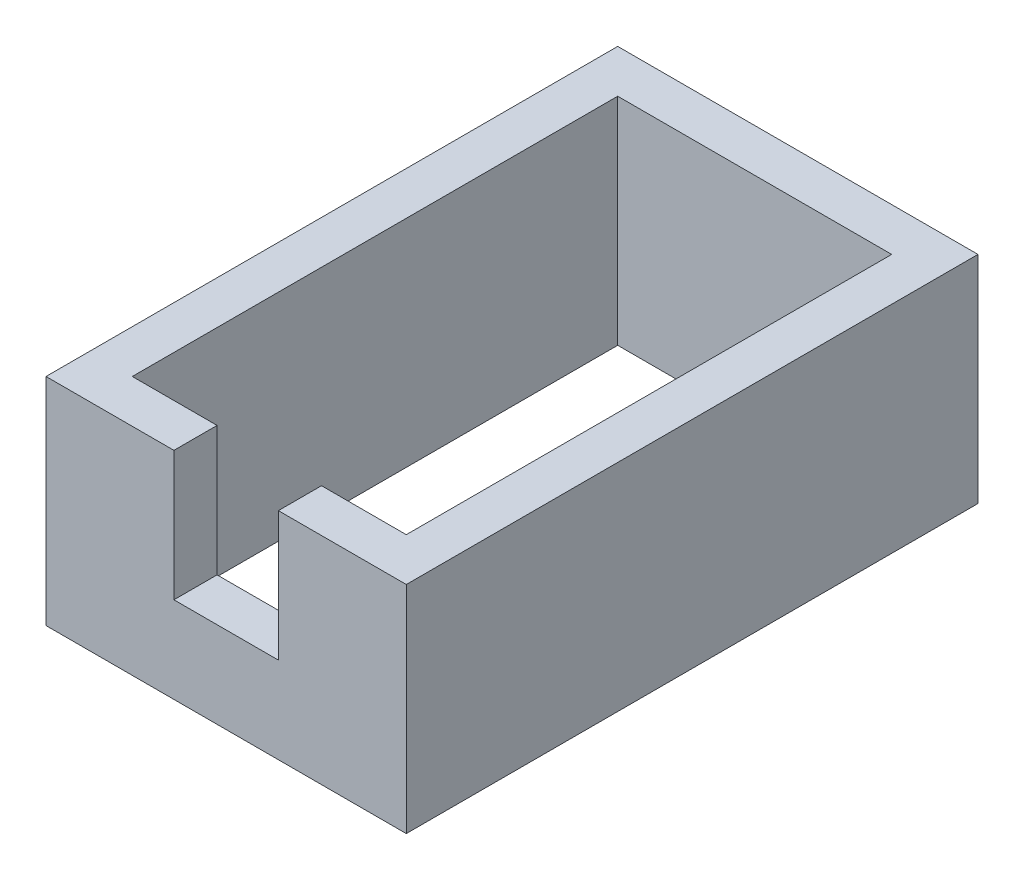
from build123d import *

# Parameters (mm, degrees)
BOSS_EXTRUDE1_DEPTH = 10
SKETCH1_3_W         = 4.841500156
SKETCH1_3_H         = 2
BOSS_EXTRUDE2_DEPTH = 4


with BuildPart() as part:
    # Sketch1 → Boss-Extrude1 (new body)
    with BuildSketch(Plane(origin=(0, 0, 0), x_dir=(1, 0, 0), z_dir=(0, 1, 0))):
        Polygon((3.929249922, 0), (0, 0), (0, 22.5), (12.7, 22.5), (12.7, 0), (8.770750078, 0), (8.770750078, -2), (14.7, -2), (14.7, 24.5), (-2, 24.5), (-2, -2), (3.929249922, -2), align=None)
    extrude(amount=BOSS_EXTRUDE1_DEPTH)

    # Sketch1<3> → Boss-Extrude2 (add)
    with BuildSketch(Plane(origin=(0, 0, 0), x_dir=(1, 0, 0), z_dir=(0, 1, 0))):
        with Locations((6.35, -1)):
            Rectangle(SKETCH1_3_W, SKETCH1_3_H)
    extrude(amount=BOSS_EXTRUDE2_DEPTH)


solid = part.part
